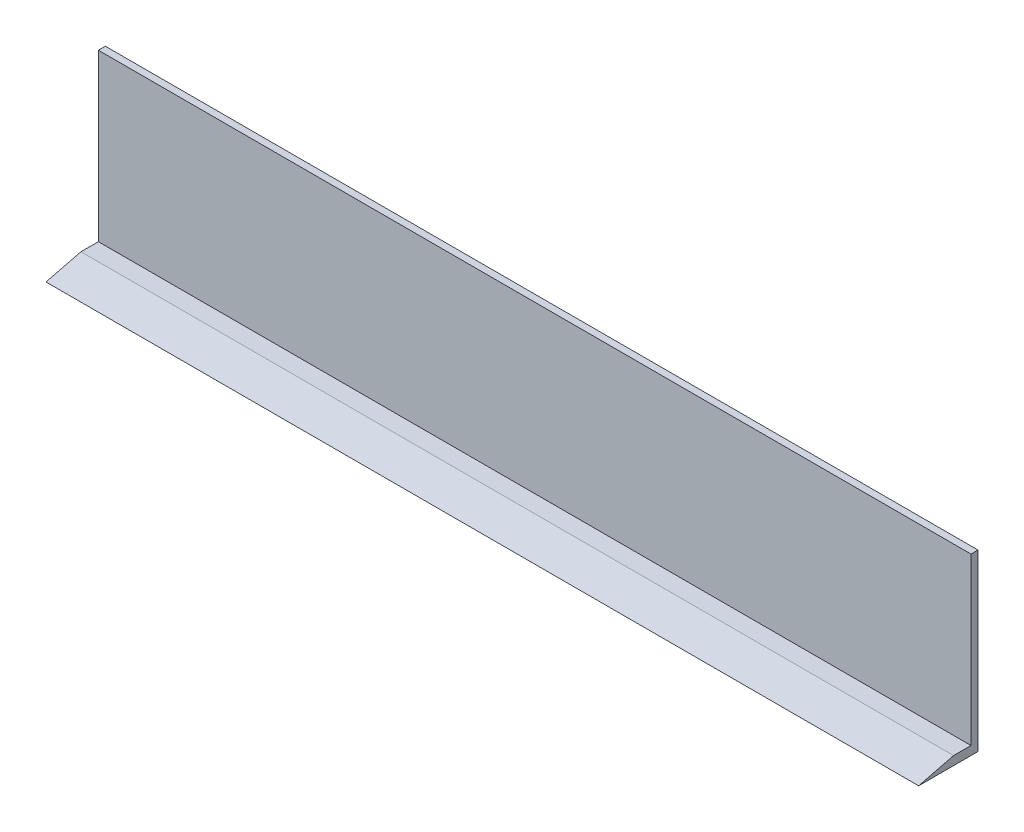
from build123d import *

# Parameters (mm, degrees)
ESQUISSE1_W        = 250
ESQUISSE1_H        = 50
BOSS_EXTRU_1_DEPTH = 2
BOSS_EXTRU_2_DEPTH = 250


with BuildPart() as part:
    # Esquisse1 → Boss.-Extru.1 (new body)
    with BuildSketch(Plane.XY):
        with Locations((-125, 25)):
            Rectangle(ESQUISSE1_W, ESQUISSE1_H)
    extrude(amount=BOSS_EXTRU_1_DEPTH)

    # Esquisse2 → Boss.-Extru.2 (add)
    with BuildSketch(Plane(origin=(0, 0, 0), x_dir=(0, 0, -1), z_dir=(1, 0, 0))):
        Polygon((-2, 0), (-17, 0), (-7, 2.5), (-2, 2.5), align=None)
    extrude(amount=-BOSS_EXTRU_2_DEPTH)


solid = part.part
